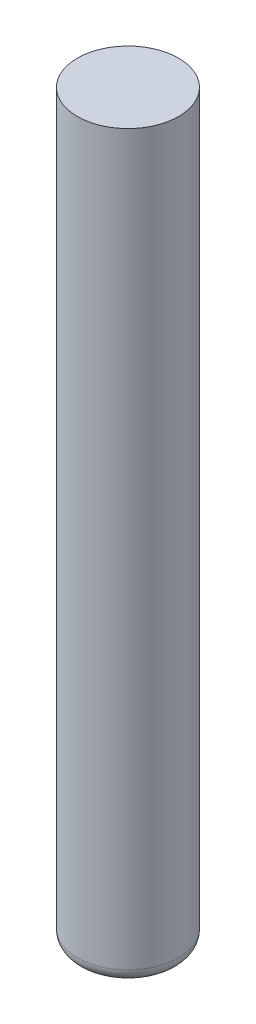
from build123d import *

# Parameters (mm, degrees)
SKETCH1_R           = 15
BOSS_EXTRUDE1_DEPTH = 220
FILLET1_R           = 4


with BuildPart() as part:
    # Sketch1 → Boss-Extrude1 (new body)
    with BuildSketch(Plane(origin=(0, 0, 0), x_dir=(1, 0, 0), z_dir=(0, 1, 0))):
        with Locations(Location((0, 0, 0), (0, 0, 270))):
            Circle(SKETCH1_R)
    extrude(amount=BOSS_EXTRUDE1_DEPTH)

    # Fillet1
    fillet1_edges = [part.edges().sort_by_distance(p)[0] for p in [
        (0, 0, -15),
    ]]
    fillet(fillet1_edges, radius=FILLET1_R)


solid = part.part
